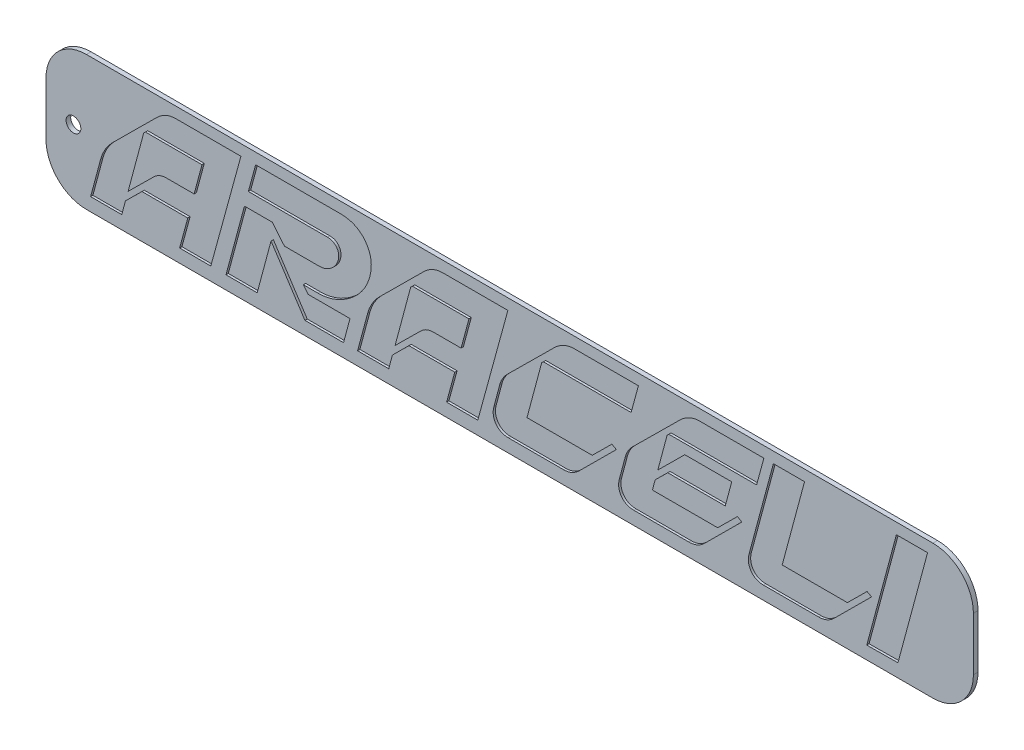
from build123d import *

# Parameters (mm, degrees)
SKETCH1_R           = 5.08
BOSS_EXTRUDE1_DEPTH = 3.175
CUT_EXTRUDE1_DEPTH  = 1.5875


with BuildPart() as part:
    # Sketch1 → Boss-Extrude1 (new body)
    with BuildSketch(Plane.XY):
        with BuildLine():
            Line((-10.87200409, 83.627383564), (573.109618204, 83.627383564))
            ThreePointArc((573.109618204, 83.627383564), (592.866181671, 75.44394703), (601.049618204, 55.687383564))
            Line((601.049618204, 55.687383564), (601.049618204, 18.930700933))
            ThreePointArc((601.049618204, 18.930700933), (592.866181671, -0.825862533), (573.109618204, -9.009299067))
            Line((573.109618204, -9.009299067), (-10.87200409, -9.009299067))
            ThreePointArc((-10.87200409, -9.009299067), (-30.628567557, -0.825862533), (-38.81200409, 18.930700933))
            Line((-38.81200409, 18.930700933), (-38.81200409, 55.687383564))
            ThreePointArc((-38.81200409, 55.687383564), (-30.628567557, 75.44394703), (-10.87200409, 83.627383564))
        make_face()
        with Locations((-19.862693149, 37.309042248)):
            Circle(SKETCH1_R, mode=Mode.SUBTRACT)
    extrude(amount=BOSS_EXTRUDE1_DEPTH)

    # Sketch2 → Cut-Extrude1 (cut)
    # profile 1 of 7: a face of its own
    with BuildSketch(Plane.XY.offset(3.175)):
        with BuildLine():
            Line((50.878637771, 76.089907121), (95.670712074, 76.089907121))
            Line((95.670712074, 76.089907121), (74.894613003, 0.110092879))
            Line((74.894613003, 0.110092879), (53.379318885, 0.110092879))
            Line((53.379318885, 0.110092879), (59.025510836, 20.870464396))
            Line((59.025510836, 20.870464396), (27.397399381, 20.870464396))
            Line((27.397399381, 20.870464396), (15.979195046, 9.562352941))
            Line((15.979195046, 9.562352941), (13.478513932, 0.110092879))
            Line((13.478513932, 0.110092879), (-8.036780186, 0.110092879))
            Line((-8.036780186, 0.110092879), (-1.085201238, 25.981919505))
            add(Edge.make_bspline(
                [(-1.085201238, 25.981919505), (-0.889549801, 26.645371072), (-0.498578973, 27.971148241), (0.247331536, 29.910929371), (1.124991072, 31.800461991), (2.159772613, 33.634395292), (3.319360425, 35.421190898), (4.611466449, 37.159516171), (6.052959397, 38.829815678), (7.087683077, 39.895431078), (7.612136223, 40.435541796)],
                knots=[0, 0, 0, 0, 0.972188851, 1.942727767, 2.918792729, 3.89888478, 4.900660299, 5.911935627, 6.941657613, 8, 8, 8, 8], degree=3))
            Line((7.612136223, 40.435541796), (37.620309598, 70.223529412))
            add(Edge.make_bspline(
                [(37.620309598, 70.223529412), (38.116153223, 70.68811599), (39.089664654, 71.600259095), (40.650770104, 72.799594193), (42.261671369, 73.806711452), (43.899230638, 74.649150324), (45.584162718, 75.305189439), (47.315417485, 75.757242357), (49.087403884, 76.032176586), (50.280030482, 76.07061432), (50.878637771, 76.089907121)],
                knots=[0, 0, 0, 0, 1.09520327, 2.15026038, 3.168190723, 4.15492977, 5.115689715, 6.0773418, 7.034972711, 8, 8, 8, 8], degree=3))
        make_face()
        with BuildLine():
            Line((63.382043344, 37.400123839), (68.808049536, 57.61003096))
            Line((68.808049536, 57.61003096), (29.787987616, 57.61003096))
            Line((29.787987616, 57.61003096), (28.592693498, 56.414736842))
            Line((28.592693498, 56.414736842), (17.83504644, 16.199380805))
            Line((17.83504644, 16.199380805), (35.324086687, 33.483962848))
            add(Edge.make_bspline(
                [(35.324086687, 33.483962848), (35.649545482, 33.793484328), (36.289010541, 34.401635574), (37.313282679, 35.204466573), (38.372830374, 35.892296283), (39.469616659, 36.433077589), (40.586985048, 36.874999281), (41.74035848, 37.163848907), (42.923940587, 37.365984392), (43.726980521, 37.388687169), (44.131517028, 37.400123839)],
                knots=[0, 0, 0, 0, 1.088018936, 2.137751703, 3.149265309, 4.143636785, 5.096896491, 6.055307392, 7.020348651, 8, 8, 8, 8], degree=3))
            Line((44.131517028, 37.400123839), (63.382043344, 37.400123839))
        make_face(mode=Mode.SUBTRACT)
    # profile 2 of 7: a face of its own
    with BuildSketch(Plane.XY.offset(3.175)):
        with BuildLine():
            add(Edge.make_bspline(
                [(181.684705882, 68.053126935), (182.153903389, 67.366880996), (183.084175893, 66.00626906), (184.151179969, 63.778867775), (184.941991476, 61.455712397), (185.454747871, 59.021807131), (185.648339709, 56.475326223), (185.563304406, 53.824684264), (185.201120457, 51.062974752), (184.7487514, 49.218328433), (184.515665635, 48.267863777)],
                knots=[0, 0, 0, 0, 0.961877665, 1.907103789, 2.850083582, 3.799378563, 4.780335239, 5.801073342, 6.866990356, 8, 8, 8, 8], degree=3))
            add(Edge.make_bspline(
                [(184.515665635, 48.267863777), (184.234433955, 47.328517157), (183.674022936, 45.456678976), (182.518419348, 42.757827303), (181.158688271, 40.156151552), (179.533432772, 37.680442163), (177.710152568, 35.293817541), (175.63286713, 33.025908899), (173.340605233, 30.854340343), (170.837156198, 28.836012309), (168.225941375, 26.969939526), (165.529588925, 25.358836502), (162.821877969, 23.948270612), (160.059281956, 22.845379686), (157.28537248, 21.94185992), (154.464617761, 21.339803128), (151.619740266, 20.942101185), (149.706670906, 20.894325491), (148.75120743, 20.870464396)],
                knots=[0, 0, 0, 0, 0.97804993, 1.948962355, 2.925064492, 3.904792855, 4.901205012, 5.919903121, 6.971183752, 8.049975335, 9.127306388, 10.171923768, 11.182945394, 12.171203276, 13.137691742, 14.09124472, 15.046691149, 16, 16, 16, 16], degree=3))
            Line((148.75120743, 20.870464396), (138.748482972, 20.870464396))
            Line((138.748482972, 20.870464396), (142.004086687, 16.734117647))
            Line((142.004086687, 16.734117647), (170.927058824, 16.734117647))
            Line((170.927058824, 16.734117647), (166.476160991, 0.110092879))
            Line((166.476160991, 0.110092879), (139.833684211, 0.110092879))
            Line((139.833684211, 0.110092879), (116.4625387, 35.874551084))
            Line((116.4625387, 35.874551084), (106.900185759, 0.110092879))
            Line((106.900185759, 0.110092879), (85.369164087, 0.110092879))
            Line((85.369164087, 0.110092879), (98.092755418, 47.512941176))
            Line((98.092755418, 47.512941176), (117.32755418, 47.512941176))
            Line((117.32755418, 47.512941176), (125.710340557, 37.400123839))
            Line((125.710340557, 37.400123839), (150.056594427, 37.400123839))
            add(Edge.make_bspline(
                [(150.056594427, 37.400123839), (150.742091068, 37.436394395), (152.120703767, 37.509338662), (154.142426311, 38.11136999), (156.108760757, 39.059735067), (157.974382034, 40.351378107), (159.655780257, 41.892526958), (161.077708797, 43.603529672), (162.122238544, 45.485540346), (162.827463259, 47.457155267), (163.18960497, 49.431927622), (163.137733132, 51.327686473), (162.670718354, 53.087542036), (161.80350368, 54.655633883), (160.606031484, 55.973268562), (159.110065535, 56.959900226), (157.322564804, 57.509782064), (156.052493202, 57.575605015), (155.388235294, 57.61003096)],
                knots=[0, 0, 0, 0, 1.024328987, 2.060043575, 3.13039622, 4.281662315, 5.442274921, 6.535335147, 7.596155383, 8.645921005, 9.657215708, 10.583586998, 11.460982792, 12.356435318, 13.239426359, 14.101212219, 15.006918353, 16, 16, 16, 16], degree=3))
            Line((155.388235294, 57.61003096), (100.813622291, 57.61003096))
            Line((100.813622291, 57.61003096), (105.81498452, 76.089907121))
            Line((105.81498452, 76.089907121), (164.29003096, 76.089907121))
            add(Edge.make_bspline(
                [(164.29003096, 76.089907121), (165.214093664, 76.067295423), (167.012678481, 76.023284279), (169.627865775, 75.63650897), (172.077414809, 75.01312084), (174.358706409, 74.134795281), (176.453988634, 72.984393262), (178.393215289, 71.605451252), (180.172346324, 69.970718569), (181.176939669, 68.696947537), (181.684705882, 68.053126935)],
                knots=[0, 0, 0, 0, 1.112653996, 2.165656695, 3.176610271, 4.152371772, 5.101949124, 6.048265736, 7.013506589, 8, 8, 8, 8], degree=3))
        make_face()
    # profile 3 of 7: a face of its own
    with BuildSketch(Plane.XY.offset(3.175)):
        with BuildLine():
            Line((235.079752322, 76.089907121), (279.871826625, 76.089907121))
            Line((279.871826625, 76.089907121), (259.095727554, 0.110092879))
            Line((259.095727554, 0.110092879), (237.580433437, 0.110092879))
            Line((237.580433437, 0.110092879), (243.226625387, 20.870464396))
            Line((243.226625387, 20.870464396), (211.598513932, 20.870464396))
            Line((211.598513932, 20.870464396), (200.180309598, 9.562352941))
            Line((200.180309598, 9.562352941), (197.679628483, 0.110092879))
            Line((197.679628483, 0.110092879), (176.164334365, 0.110092879))
            Line((176.164334365, 0.110092879), (183.115913313, 25.981919505))
            add(Edge.make_bspline(
                [(183.115913313, 25.981919505), (183.31156475, 26.645371072), (183.702535578, 27.971148241), (184.448446087, 29.910929371), (185.326105623, 31.800461991), (186.360887164, 33.634395292), (187.520474977, 35.421190898), (188.812581, 37.159516171), (190.254073948, 38.829815678), (191.288797628, 39.895431078), (191.813250774, 40.435541796)],
                knots=[0, 0, 0, 0, 0.972188851, 1.942727767, 2.918792729, 3.89888478, 4.900660299, 5.911935627, 6.941657613, 8, 8, 8, 8], degree=3))
            Line((191.813250774, 40.435541796), (221.821424149, 70.223529412))
            add(Edge.make_bspline(
                [(221.821424149, 70.223529412), (222.317267774, 70.68811599), (223.290779205, 71.600259095), (224.851884655, 72.799594193), (226.462785921, 73.806711452), (228.100345189, 74.649150324), (229.785277269, 75.305189439), (231.516532036, 75.757242357), (233.288518435, 76.032176586), (234.481145033, 76.07061432), (235.079752322, 76.089907121)],
                knots=[0, 0, 0, 0, 1.09520327, 2.15026038, 3.168190723, 4.15492977, 5.115689715, 6.0773418, 7.034972711, 8, 8, 8, 8], degree=3))
        make_face()
        with BuildLine():
            Line((247.583157895, 37.400123839), (253.009164087, 57.61003096))
            Line((253.009164087, 57.61003096), (213.989102167, 57.61003096))
            Line((213.989102167, 57.61003096), (212.79380805, 56.414736842))
            Line((212.79380805, 56.414736842), (202.036160991, 16.199380805))
            Line((202.036160991, 16.199380805), (219.525201238, 33.483962848))
            add(Edge.make_bspline(
                [(219.525201238, 33.483962848), (219.850660033, 33.793484328), (220.490125092, 34.401635574), (221.51439723, 35.204466573), (222.573944925, 35.892296283), (223.67073121, 36.433077589), (224.788099599, 36.874999281), (225.941473031, 37.163848907), (227.125055138, 37.365984392), (227.928095072, 37.388687169), (228.332631579, 37.400123839)],
                knots=[0, 0, 0, 0, 1.088018936, 2.137751703, 3.149265309, 4.143636785, 5.096896491, 6.055307392, 7.020348651, 8, 8, 8, 8], degree=3))
            Line((228.332631579, 37.400123839), (247.583157895, 37.400123839))
        make_face(mode=Mode.SUBTRACT)
    # profile 4 of 7: a face of its own
    with BuildSketch(Plane.XY.offset(3.175)):
        with BuildLine():
            Line((304.359628483, 57.61003096), (303.164334365, 56.414736842))
            Line((303.164334365, 56.414736842), (293.051517028, 18.58996904))
            Line((293.051517028, 18.58996904), (338.06377709, 18.58996904))
            Line((338.06377709, 18.58996904), (351.652383901, 32.068482972))
            Line((351.652383901, 32.068482972), (354.687801858, 30.322724458))
            Line((354.687801858, 30.322724458), (329.036160991, 4.781176471))
            add(Edge.make_bspline(
                [(329.036160991, 4.781176471), (328.639830456, 4.40563779), (327.862641681, 3.669221032), (326.592871395, 2.72983858), (325.300684745, 1.922007685), (323.973788661, 1.249330178), (322.598350016, 0.749693532), (321.192417446, 0.386207664), (319.748603091, 0.157196007), (318.772148494, 0.125909425), (318.278513932, 0.110092879)],
                knots=[0, 0, 0, 0, 1.087710149, 2.132957327, 3.142311131, 4.123953504, 5.092881289, 6.053713067, 7.016078678, 8, 8, 8, 8], degree=3))
            Line((318.278513932, 0.110092879), (280.233560372, 0.110092879))
            add(Edge.make_bspline(
                [(280.233560372, 0.110092879), (279.776774545, 0.121495697), (278.885328422, 0.143749009), (277.58814602, 0.336897705), (276.373543909, 0.647440779), (275.244985461, 1.086514673), (274.215326961, 1.669343073), (273.24190268, 2.337531495), (272.376294261, 3.167267257), (271.609565868, 4.11011912), (270.951584554, 5.138224272), (270.433707214, 6.234858978), (270.02692862, 7.369301457), (269.800713342, 8.568042434), (269.685704495, 9.811604079), (269.723437979, 11.108834081), (269.894086817, 12.453440135), (270.116673772, 13.3493112), (270.230835913, 13.80879257)],
                knots=[0, 0, 0, 0, 1.094945795, 2.136855229, 3.137044923, 4.096584279, 5.030749513, 5.969051044, 6.920650617, 7.894578144, 8.878114772, 9.839711021, 10.797931648, 11.759527897, 12.756631189, 13.787866602, 14.865423694, 16, 16, 16, 16], degree=3))
            Line((270.230835913, 13.80879257), (274.257089783, 28.922972136))
            add(Edge.make_bspline(
                [(274.257089783, 28.922972136), (274.518824507, 29.762249011), (275.043674315, 31.445229009), (276.322358696, 33.789754209), (277.851451771, 36.050838621), (279.136958418, 37.371021477), (279.793188854, 38.04495356)],
                knots=[0, 0, 0, 0, 0.975136166, 1.955415087, 2.956272335, 4, 4, 4, 4], degree=3))
            Line((279.793188854, 38.04495356), (311.861671827, 69.798885449))
            add(Edge.make_bspline(
                [(311.861671827, 69.798885449), (312.387855167, 70.301463912), (313.414098329, 71.281669234), (315.066864941, 72.559024637), (316.751238365, 73.662817435), (318.500720467, 74.531301715), (320.27761599, 75.247349918), (322.112293634, 75.724007994), (323.987107164, 76.040497331), (325.255014057, 76.073408073), (325.890650155, 76.089907121)],
                knots=[0, 0, 0, 0, 1.104987577, 2.155115633, 3.169368792, 4.159784375, 5.118388166, 6.074904324, 7.034897349, 8, 8, 8, 8], degree=3))
            Line((325.890650155, 76.089907121), (369.912074303, 76.089907121))
            Line((369.912074303, 76.089907121), (364.910712074, 57.61003096))
            Line((364.910712074, 57.61003096), (304.359628483, 57.61003096))
        make_face()
    # profile 5 of 7: a face of its own
    with BuildSketch(Plane.XY.offset(3.175)):
        with BuildLine():
            Line((390.924086687, 57.61003096), (389.72879257, 56.414736842))
            Line((389.72879257, 56.414736842), (383.311950464, 32.39876161))
            Line((383.311950464, 32.39876161), (401.901919505, 50.878637771))
            Line((401.901919505, 50.878637771), (434.300681115, 50.878637771))
            Line((434.300681115, 50.878637771), (429.849783282, 34.238885449))
            Line((429.849783282, 34.238885449), (390.169164087, 34.238885449))
            Line((390.169164087, 34.238885449), (381.471826625, 25.651640867))
            Line((381.471826625, 25.651640867), (379.615975232, 18.58996904))
            Line((379.615975232, 18.58996904), (424.628235294, 18.58996904))
            Line((424.628235294, 18.58996904), (438.216842105, 32.068482972))
            Line((438.216842105, 32.068482972), (441.252260062, 30.322724458))
            Line((441.252260062, 30.322724458), (415.600619195, 4.781176471))
            add(Edge.make_bspline(
                [(415.600619195, 4.781176471), (415.20428866, 4.40563779), (414.427099886, 3.669221032), (413.157329599, 2.72983858), (411.865142949, 1.922007685), (410.538246865, 1.249330178), (409.16280822, 0.749693532), (407.75687565, 0.386207664), (406.313061295, 0.157196007), (405.336606698, 0.125909425), (404.842972136, 0.110092879)],
                knots=[0, 0, 0, 0, 1.087710149, 2.132957327, 3.142311131, 4.123953504, 5.092881289, 6.053713067, 7.016078678, 8, 8, 8, 8], degree=3))
            Line((404.842972136, 0.110092879), (366.798018576, 0.110092879))
            add(Edge.make_bspline(
                [(366.798018576, 0.110092879), (366.341232749, 0.121495697), (365.449786626, 0.143749009), (364.152604225, 0.336897705), (362.938002113, 0.647440779), (361.809443665, 1.086514673), (360.779785165, 1.669343073), (359.806360885, 2.337531495), (358.940752465, 3.167267257), (358.174024072, 4.11011912), (357.516042759, 5.138224272), (356.998165418, 6.234858978), (356.591386825, 7.369301457), (356.365171547, 8.568042434), (356.2501627, 9.811604079), (356.287896183, 11.108834081), (356.458545021, 12.453440135), (356.681131976, 13.3493112), (356.795294118, 13.80879257)],
                knots=[0, 0, 0, 0, 1.094945795, 2.136855229, 3.137044923, 4.096584279, 5.030749513, 5.969051044, 6.920650617, 7.894578144, 8.878114772, 9.839711021, 10.797931648, 11.759527897, 12.756631189, 13.787866602, 14.865423694, 16, 16, 16, 16], degree=3))
            Line((356.795294118, 13.80879257), (360.821547988, 28.922972136))
            add(Edge.make_bspline(
                [(360.821547988, 28.922972136), (361.083282712, 29.762249011), (361.608132519, 31.445229009), (362.886816901, 33.789754209), (364.415909975, 36.050838621), (365.701416622, 37.371021477), (366.357647059, 38.04495356)],
                knots=[0, 0, 0, 0, 0.975136166, 1.955415087, 2.956272335, 4, 4, 4, 4], degree=3))
            Line((366.357647059, 38.04495356), (398.426130031, 69.798885449))
            add(Edge.make_bspline(
                [(398.426130031, 69.798885449), (398.952313372, 70.301463912), (399.978556533, 71.281669234), (401.631323146, 72.559024637), (403.315696569, 73.662817435), (405.065178672, 74.531301715), (406.842074194, 75.247349918), (408.676751839, 75.724007994), (410.551565368, 76.040497331), (411.819472261, 76.073408073), (412.455108359, 76.089907121)],
                knots=[0, 0, 0, 0, 1.104987577, 2.155115633, 3.169368792, 4.159784375, 5.118388166, 6.074904324, 7.034897349, 8, 8, 8, 8], degree=3))
            Line((412.455108359, 76.089907121), (456.476532508, 76.089907121))
            Line((456.476532508, 76.089907121), (451.475170279, 57.61003096))
            Line((451.475170279, 57.61003096), (390.924086687, 57.61003096))
        make_face()
    # profile 6 of 7: a face of its own
    with BuildSketch(Plane.XY.offset(3.175)):
        with BuildLine():
            Line((527.706625387, 32.068482972), (530.757770898, 30.322724458))
            Line((530.757770898, 30.322724458), (505.106130031, 4.781176471))
            add(Edge.make_bspline(
                [(505.106130031, 4.781176471), (504.709799496, 4.40563779), (503.932610721, 3.669221032), (502.662840435, 2.72983858), (501.370653785, 1.922007685), (500.043757701, 1.249330178), (498.668319056, 0.749693532), (497.262386486, 0.386207664), (495.818572131, 0.157196007), (494.842117534, 0.125909425), (494.348482972, 0.110092879)],
                knots=[0, 0, 0, 0, 1.087710149, 2.132957327, 3.142311131, 4.123953504, 5.092881289, 6.053713067, 7.016078678, 8, 8, 8, 8], degree=3))
            Line((494.348482972, 0.110092879), (456.287801858, 0.110092879))
            add(Edge.make_bspline(
                [(456.287801858, 0.110092879), (455.831040479, 0.121621832), (454.939642068, 0.144121304), (453.647150594, 0.334773511), (452.438511367, 0.649496851), (451.312590833, 1.091327884), (450.27384126, 1.659580652), (449.310952539, 2.343706497), (448.445657812, 3.166376748), (447.679702293, 4.110362694), (447.021503563, 5.138161109), (446.503711603, 6.234872938), (446.096805678, 7.369307909), (445.871021584, 8.568001884), (445.754339624, 9.811768548), (445.798644368, 11.107540846), (445.942844835, 12.454761965), (446.169002837, 13.349547814), (446.285077399, 13.80879257)],
                knots=[0, 0, 0, 0, 1.095831677, 2.138584084, 3.127409683, 4.087725369, 5.033673088, 5.96247791, 6.914847389, 7.889562886, 8.87389526, 9.836269502, 10.795265392, 11.757639634, 12.755549648, 13.787619398, 14.864505748, 16, 16, 16, 16], degree=3))
            Line((446.285077399, 13.80879257), (463.034922601, 76.089907121))
            Line((463.034922601, 76.089907121), (484.550216718, 76.089907121))
            Line((484.550216718, 76.089907121), (469.121486068, 18.58996904))
            Line((469.121486068, 18.58996904), (514.118018576, 18.58996904))
            Line((514.118018576, 18.58996904), (527.706625387, 32.068482972))
        make_face()
    # profile 7 of 7: a face of its own
    with BuildSketch(Plane.XY.offset(3.175)):
        Polygon((547.916532508, 76.089907121), (569.431826625, 76.089907121), (549.001733746, 0.110092879), (527.470712074, -0.110092879), align=None)
    extrude(amount=-CUT_EXTRUDE1_DEPTH, mode=Mode.SUBTRACT)


solid = part.part
